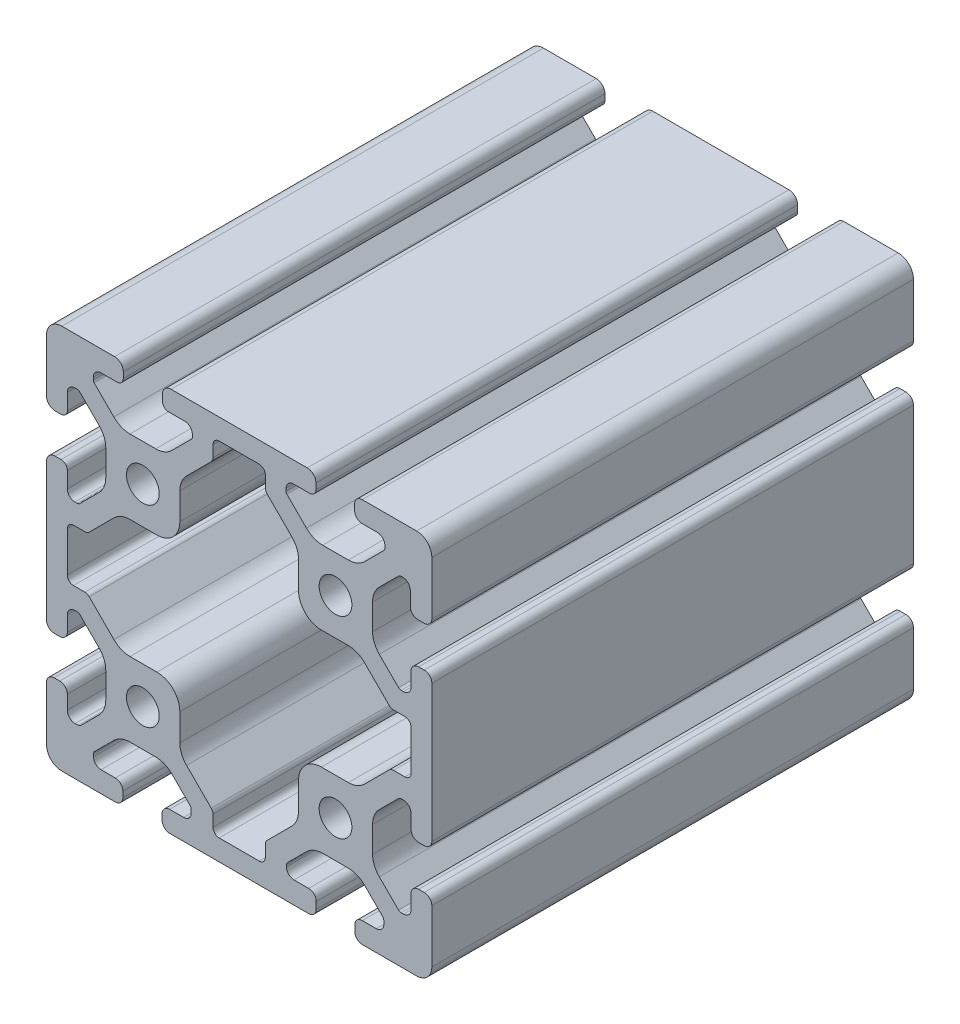
from build123d import *

# Parameters (mm, degrees)
SKETCH1_R      = 3.4
EXTRUDE1_DEPTH = 100


with BuildPart() as part:
    # Sketch1 → Extrude1 (new body)
    with BuildSketch(Plane.XY):
        with BuildLine():
            Line((29.091242789, 26.036541495), (33.082657296, 30.027956002))
            ThreePointArc((33.082657296, 30.027956002), (33.329219041, 30.192703293), (33.62005845, 30.250554848))
            Line((33.62005845, 30.250554848), (33.955571436, 30.250554848))
            ThreePointArc((33.955571436, 30.250554848), (35.065729082, 29.790712494), (35.525571436, 28.680554848))
            Line((35.525571436, 28.680554848), (35.525571436, 25.777866899))
            ThreePointArc((35.525571436, 25.777866899), (35.985413789, 24.667709253), (37.095571436, 24.207866899))
            Line((37.095571436, 24.207866899), (38.43, 24.207866899))
            ThreePointArc((38.43, 24.207866899), (39.540157646, 24.667709253), (40, 25.777866899))
            Line((40, 25.777866899), (40, 32.933852749))
            Line((40, 32.933852749), (40, 36.83))
            ThreePointArc((40, 36.83), (39.071528496, 39.071528496), (36.83, 40))
            Line((36.83, 40), (25.540851266, 40))
            ThreePointArc((25.540851266, 40), (24.43069362, 39.540157646), (23.970851266, 38.43))
            Line((23.970851266, 38.43), (23.970851266, 37.249043598))
            ThreePointArc((23.970851266, 37.249043598), (24.43069362, 36.138885952), (25.540851266, 35.679043598))
            Line((25.540851266, 35.679043598), (28.625762638, 35.679043598))
            ThreePointArc((28.625762638, 35.679043598), (29.77116849, 35.239363487), (30.250554848, 34.11))
            Line((30.250554848, 34.11), (30.250554848, 33.62005845))
            ThreePointArc((30.250554848, 33.62005845), (30.192703293, 33.329219041), (30.027956002, 33.082657296))
            Line((30.027956002, 33.082657296), (26.036541495, 29.091242789))
            ThreePointArc((26.036541495, 29.091242789), (24.495530588, 28.061572221), (22.677784284, 27.7))
            Line((22.677784284, 27.7), (17.322215716, 27.7))
            ThreePointArc((17.322215716, 27.7), (15.504469412, 28.061572221), (13.963458505, 29.091242789))
            Line((13.963458505, 29.091242789), (9.90393336, 33.150767934))
            ThreePointArc((9.90393336, 33.150767934), (9.764102181, 33.360040084), (9.715, 33.606893415))
            Line((9.715, 33.606893415), (9.715, 34.096834965))
            ThreePointArc((9.715, 34.096834965), (10.178698303, 35.216301697), (11.298165035, 35.68))
            Line((11.298165035, 35.68), (14.642754087, 35.68))
            ThreePointArc((14.642754087, 35.68), (15.560045469, 36.059954531), (15.94, 36.977245913))
            Line((15.94, 36.977245913), (15.94, 38.194841282))
            ThreePointArc((15.94, 38.194841282), (15.411281253, 39.471281253), (14.134841282, 40))
            Line((14.134841282, 40), (6.984433948, 40))
            Line((6.984433948, 40), (-6.984433948, 40))
            Line((-6.984433948, 40), (-14.134841282, 40))
            ThreePointArc((-14.134841282, 40), (-15.411281253, 39.471281253), (-15.94, 38.194841282))
            Line((-15.94, 38.194841282), (-15.94, 36.977245913))
            ThreePointArc((-15.94, 36.977245913), (-15.560045469, 36.059954531), (-14.642754087, 35.68))
            Line((-14.642754087, 35.68), (-11.298165035, 35.68))
            ThreePointArc((-11.298165035, 35.68), (-10.178698303, 35.216301697), (-9.715, 34.096834965))
            Line((-9.715, 34.096834965), (-9.715, 33.606893415))
            ThreePointArc((-9.715, 33.606893415), (-9.764102181, 33.360040084), (-9.90393336, 33.150767934))
            Line((-9.90393336, 33.150767934), (-13.963458505, 29.091242789))
            ThreePointArc((-13.963458505, 29.091242789), (-15.504469412, 28.061572221), (-17.322215716, 27.7))
            Line((-17.322215716, 27.7), (-22.677784284, 27.7))
            ThreePointArc((-22.677784284, 27.7), (-24.495530588, 28.061572221), (-26.036541495, 29.091242789))
            Line((-26.036541495, 29.091242789), (-30.09606664, 33.150767934))
            ThreePointArc((-30.09606664, 33.150767934), (-30.235897819, 33.360040084), (-30.285, 33.606893415))
            Line((-30.285, 33.606893415), (-30.285, 34.096834965))
            ThreePointArc((-30.285, 34.096834965), (-29.821301697, 35.216301697), (-28.701834965, 35.68))
            Line((-28.701834965, 35.68), (-25.357245913, 35.68))
            ThreePointArc((-25.357245913, 35.68), (-24.439954531, 36.059954531), (-24.06, 36.977245913))
            Line((-24.06, 36.977245913), (-24.06, 38.194841282))
            ThreePointArc((-24.06, 38.194841282), (-24.588718747, 39.471281253), (-25.865158718, 40))
            Line((-25.865158718, 40), (-33.031395847, 40))
            Line((-33.031395847, 40), (-36.83, 40))
            ThreePointArc((-36.83, 40), (-39.071528496, 39.071528496), (-40, 36.83))
            Line((-40, 36.83), (-40, 33.318079463))
            Line((-40, 33.318079463), (-40, 25.865158718))
            ThreePointArc((-40, 25.865158718), (-39.471281253, 24.588718747), (-38.194841282, 24.06))
            Line((-38.194841282, 24.06), (-36.977245913, 24.06))
            ThreePointArc((-36.977245913, 24.06), (-36.059954531, 24.439954531), (-35.68, 25.357245913))
            Line((-35.68, 25.357245913), (-35.68, 28.680554848))
            ThreePointArc((-35.68, 28.680554848), (-35.220157646, 29.790712494), (-34.11, 30.250554848))
            Line((-34.11, 30.250554848), (-33.62005845, 30.250554848))
            ThreePointArc((-33.62005845, 30.250554848), (-33.329219041, 30.192703293), (-33.082657296, 30.027956002))
            Line((-33.082657296, 30.027956002), (-29.091242789, 26.036541495))
            ThreePointArc((-29.091242789, 26.036541495), (-28.061572221, 24.495530588), (-27.7, 22.677784284))
            Line((-27.7, 22.677784284), (-27.7, 17.322215716))
            ThreePointArc((-27.7, 17.322215716), (-28.061572221, 15.504469412), (-29.091242789, 13.963458505))
            Line((-29.091242789, 13.963458505), (-33.082657296, 9.972043998))
            ThreePointArc((-33.082657296, 9.972043998), (-33.329219041, 9.807296707), (-33.62005845, 9.749445152))
            Line((-33.62005845, 9.749445152), (-34.11, 9.749445152))
            ThreePointArc((-34.11, 9.749445152), (-35.220157646, 10.209287506), (-35.68, 11.319445152))
            Line((-35.68, 11.319445152), (-35.68, 14.642754087))
            ThreePointArc((-35.68, 14.642754087), (-36.059954531, 15.560045469), (-36.977245913, 15.94))
            Line((-36.977245913, 15.94), (-38.194841282, 15.94))
            ThreePointArc((-38.194841282, 15.94), (-39.471281253, 15.411281253), (-40, 14.134841282))
            Line((-40, 14.134841282), (-40, 7.016888977))
            Line((-40, 7.016888977), (-40, -7.016888977))
            Line((-40, -7.016888977), (-40, -14.447338303))
            ThreePointArc((-40, -14.447338303), (-39.540157646, -15.557495949), (-38.43, -16.017338303))
            Line((-38.43, -16.017338303), (-37.25, -16.017338303))
            ThreePointArc((-37.25, -16.017338303), (-36.139842354, -15.557495949), (-35.68, -14.447338303))
            Line((-35.68, -14.447338303), (-35.68, -11.319445152))
            ThreePointArc((-35.68, -11.319445152), (-35.220157646, -10.209287506), (-34.11, -9.749445152))
            Line((-34.11, -9.749445152), (-33.62005845, -9.749445152))
            ThreePointArc((-33.62005845, -9.749445152), (-33.329219041, -9.807296707), (-33.082657296, -9.972043998))
            Line((-33.082657296, -9.972043998), (-29.091242789, -13.963458505))
            ThreePointArc((-29.091242789, -13.963458505), (-28.061572221, -15.504469412), (-27.7, -17.322215716))
            Line((-27.7, -17.322215716), (-27.7, -22.677784284))
            ThreePointArc((-27.7, -22.677784284), (-28.061572221, -24.495530588), (-29.091242789, -26.036541495))
            Line((-29.091242789, -26.036541495), (-32.871776968, -29.817075674))
            ThreePointArc((-32.871776968, -29.817075674), (-33.10612883, -29.976640176), (-33.382654504, -30.039211548))
            Line((-33.382654504, -30.039211548), (-34.05520779, -30.062697627))
            ThreePointArc((-34.05520779, -30.062697627), (-35.200613642, -29.623017515), (-35.68, -28.493654028))
            Line((-35.68, -28.493654028), (-35.68, -25.59096608))
            ThreePointArc((-35.68, -25.59096608), (-36.139842354, -24.480808433), (-37.25, -24.02096608))
            Line((-37.25, -24.02096608), (-38.43, -24.02096608))
            ThreePointArc((-38.43, -24.02096608), (-39.540157646, -24.480808433), (-40, -25.59096608))
            Line((-40, -25.59096608), (-40, -33.019082273))
            Line((-40, -33.019082273), (-40, -36.83))
            ThreePointArc((-40, -36.83), (-39.071528496, -39.071528496), (-36.83, -40))
            Line((-36.83, -40), (-33, -40))
            Line((-33, -40), (-25.72307469, -40))
            ThreePointArc((-25.72307469, -40), (-24.612917043, -39.540157646), (-24.15307469, -38.43))
            Line((-24.15307469, -38.43), (-24.15307469, -37.25))
            ThreePointArc((-24.15307469, -37.25), (-24.612917043, -36.139842354), (-25.72307469, -35.68))
            Line((-25.72307469, -35.68), (-28.680554848, -35.68))
            ThreePointArc((-28.680554848, -35.68), (-29.790712494, -35.220157646), (-30.250554848, -34.11))
            Line((-30.250554848, -34.11), (-30.250554848, -33.62005845))
            ThreePointArc((-30.250554848, -33.62005845), (-30.192703293, -33.329219041), (-30.027956002, -33.082657296))
            Line((-30.027956002, -33.082657296), (-26.036541495, -29.091242789))
            ThreePointArc((-26.036541495, -29.091242789), (-24.495530588, -28.061572221), (-22.677784284, -27.7))
            Line((-22.677784284, -27.7), (-17.322215716, -27.7))
            ThreePointArc((-17.322215716, -27.7), (-15.504469412, -28.061572221), (-13.963458505, -29.091242789))
            Line((-13.963458505, -29.091242789), (-10.203784275, -32.85091702))
            ThreePointArc((-10.203784275, -32.85091702), (-10.044219772, -33.085268882), (-9.9816484, -33.361794556))
            Line((-9.9816484, -33.361794556), (-9.957433876, -34.05520779))
            ThreePointArc((-9.957433876, -34.05520779), (-10.397113988, -35.200613642), (-11.526477474, -35.68))
            Line((-11.526477474, -35.68), (-14.429165423, -35.68))
            ThreePointArc((-14.429165423, -35.68), (-15.539323069, -36.139842354), (-15.999165423, -37.25))
            Line((-15.999165423, -37.25), (-15.999165423, -38.43))
            ThreePointArc((-15.999165423, -38.43), (-15.539323069, -39.540157646), (-14.429165423, -40))
            Line((-14.429165423, -40), (-6.998716097, -40))
            Line((-6.998716097, -40), (6.998716097, -40))
            Line((6.998716097, -40), (14.424638994, -40))
            ThreePointArc((14.424638994, -40), (15.53479664, -39.540157646), (15.994638994, -38.43))
            Line((15.994638994, -38.43), (15.994638994, -37.032644306))
            ThreePointArc((15.994638994, -37.032644306), (15.53479664, -35.922486659), (14.424638994, -35.462644306))
            Line((14.424638994, -35.462644306), (11.382372282, -35.462644306))
            ThreePointArc((11.382372282, -35.462644306), (10.272214636, -35.002801952), (9.812372282, -33.892644306))
            Line((9.812372282, -33.892644306), (9.812372282, -33.55713132))
            ThreePointArc((9.812372282, -33.55713132), (9.870223837, -33.266291912), (10.034971128, -33.019730166))
            Line((10.034971128, -33.019730166), (13.963458505, -29.091242789))
            ThreePointArc((13.963458505, -29.091242789), (15.504469412, -28.061572221), (17.322215716, -27.7))
            Line((17.322215716, -27.7), (22.677784284, -27.7))
            ThreePointArc((22.677784284, -27.7), (24.495530588, -28.061572221), (26.036541495, -29.091242789))
            Line((26.036541495, -29.091242789), (29.794925243, -32.849626538))
            ThreePointArc((29.794925243, -32.849626538), (29.954489746, -33.083978399), (30.017061118, -33.360504074))
            Line((30.017061118, -33.360504074), (30.041320706, -34.05520779))
            ThreePointArc((30.041320706, -34.05520779), (29.601640594, -35.200613642), (28.472277108, -35.68))
            Line((28.472277108, -35.68), (25.569589159, -35.68))
            ThreePointArc((25.569589159, -35.68), (24.459431513, -36.139842354), (23.999589159, -37.25))
            Line((23.999589159, -37.25), (23.999589159, -38.43))
            ThreePointArc((23.999589159, -38.43), (24.459431513, -39.540157646), (25.569589159, -40))
            Line((25.569589159, -40), (32.999849358, -40))
            Line((32.999849358, -40), (36.83, -40))
            ThreePointArc((36.83, -40), (39.071528496, -39.071528496), (40, -36.83))
            Line((40, -36.83), (40, -33.025941835))
            Line((40, -33.025941835), (40, -25.777866899))
            ThreePointArc((40, -25.777866899), (39.540157646, -24.667709253), (38.43, -24.207866899))
            Line((38.43, -24.207866899), (37.25, -24.207866899))
            ThreePointArc((37.25, -24.207866899), (36.139842354, -24.667709253), (35.68, -25.777866899))
            Line((35.68, -25.777866899), (35.68, -28.680554848))
            ThreePointArc((35.68, -28.680554848), (35.220157646, -29.790712494), (34.11, -30.250554848))
            Line((34.11, -30.250554848), (33.62005845, -30.250554848))
            ThreePointArc((33.62005845, -30.250554848), (33.329219041, -30.192703293), (33.082657296, -30.027956002))
            Line((33.082657296, -30.027956002), (29.091242789, -26.036541495))
            ThreePointArc((29.091242789, -26.036541495), (28.061572221, -24.495530588), (27.7, -22.677784284))
            Line((27.7, -22.677784284), (27.7, -17.322215716))
            ThreePointArc((27.7, -17.322215716), (28.061572221, -15.504469412), (29.091242789, -13.963458505))
            Line((29.091242789, -13.963458505), (33.082657296, -9.972043998))
            ThreePointArc((33.082657296, -9.972043998), (33.329219041, -9.807296707), (33.62005845, -9.749445152))
            Line((33.62005845, -9.749445152), (34.11, -9.749445152))
            ThreePointArc((34.11, -9.749445152), (35.220157646, -10.209287506), (35.68, -11.319445152))
            Line((35.68, -11.319445152), (35.68, -14.222133101))
            ThreePointArc((35.68, -14.222133101), (36.139842354, -15.332290747), (37.25, -15.792133101))
            Line((37.25, -15.792133101), (38.43, -15.792133101))
            ThreePointArc((38.43, -15.792133101), (39.540157646, -15.332290747), (40, -14.222133101))
            Line((40, -14.222133101), (40, -7.021415406))
            Line((40, -7.021415406), (40, 7.021415406))
            Line((40, 7.021415406), (40, 14.222133101))
            ThreePointArc((40, 14.222133101), (39.540157646, 15.332290747), (38.43, 15.792133101))
            Line((38.43, 15.792133101), (37.25, 15.792133101))
            ThreePointArc((37.25, 15.792133101), (36.139842354, 15.332290747), (35.68, 14.222133101))
            Line((35.68, 14.222133101), (35.68, 11.319445152))
            ThreePointArc((35.68, 11.319445152), (35.220157646, 10.209287506), (34.11, 9.749445152))
            Line((34.11, 9.749445152), (33.62005845, 9.749445152))
            ThreePointArc((33.62005845, 9.749445152), (33.329219041, 9.807296707), (33.082657296, 9.972043998))
            Line((33.082657296, 9.972043998), (29.091242789, 13.963458505))
            ThreePointArc((29.091242789, 13.963458505), (28.061572221, 15.504469412), (27.7, 17.322215716))
            Line((27.7, 17.322215716), (27.7, 22.677784284))
            ThreePointArc((27.7, 22.677784284), (28.061572221, 24.495530588), (29.091242789, 26.036541495))
        make_face()
        with Locations((-20, 20)):
            Circle(SKETCH1_R, mode=Mode.SUBTRACT)
        with Locations((20, 20)):
            Circle(SKETCH1_R, mode=Mode.SUBTRACT)
        with Locations((20, -20)):
            Circle(SKETCH1_R, mode=Mode.SUBTRACT)
        with Locations((-20, -20)):
            Circle(SKETCH1_R, mode=Mode.SUBTRACT)
        with BuildLine():
            Line((17.07, 12.32), (22.657784284, 12.32))
            ThreePointArc((22.657784284, 12.32), (24.475530588, 11.958427779), (26.016541495, 10.928757211))
            Line((26.016541495, 10.928757211), (31.143879165, 5.80141954))
            ThreePointArc((31.143879165, 5.80141954), (31.555896818, 5.526118146), (32.041904777, 5.429445152))
            Line((32.041904777, 5.429445152), (34.41, 5.429445152))
            ThreePointArc((34.41, 5.429445152), (35.308025612, 5.057470764), (35.68, 4.159445152))
            Line((35.68, 4.159445152), (35.68, -4.159445152))
            ThreePointArc((35.68, -4.159445152), (35.308025612, -5.057470764), (34.41, -5.429445152))
            Line((34.41, -5.429445152), (32.041904777, -5.429445152))
            ThreePointArc((32.041904777, -5.429445152), (31.555896818, -5.526118146), (31.143879165, -5.80141954))
            Line((31.143879165, -5.80141954), (26.016541495, -10.928757211))
            ThreePointArc((26.016541495, -10.928757211), (24.475530588, -11.958427779), (22.657784284, -12.32))
            Line((22.657784284, -12.32), (17.07, -12.32))
            ThreePointArc((17.07, -12.32), (13.711242789, -13.711242789), (12.32, -17.07))
            Line((12.32, -17.07), (12.32, -22.657784284))
            ThreePointArc((12.32, -22.657784284), (11.958427779, -24.475530588), (10.928757211, -26.016541495))
            Line((10.928757211, -26.016541495), (5.80141954, -31.143879165))
            ThreePointArc((5.80141954, -31.143879165), (5.526118146, -31.555896818), (5.429445152, -32.041904777))
            Line((5.429445152, -32.041904777), (5.429445152, -34.41))
            ThreePointArc((5.429445152, -34.41), (5.057470764, -35.308025612), (4.159445152, -35.68))
            Line((4.159445152, -35.68), (-4.159445152, -35.68))
            ThreePointArc((-4.159445152, -35.68), (-5.057470764, -35.308025612), (-5.429445152, -34.41))
            Line((-5.429445152, -34.41), (-5.429445152, -32.041904777))
            ThreePointArc((-5.429445152, -32.041904777), (-5.526118146, -31.555896818), (-5.80141954, -31.143879165))
            Line((-5.80141954, -31.143879165), (-10.928757211, -26.016541495))
            ThreePointArc((-10.928757211, -26.016541495), (-11.958427779, -24.475530588), (-12.32, -22.657784284))
            Line((-12.32, -22.657784284), (-12.32, -17.07))
            ThreePointArc((-12.32, -17.07), (-13.711242789, -13.711242789), (-17.07, -12.32))
            Line((-17.07, -12.32), (-22.657784284, -12.32))
            ThreePointArc((-22.657784284, -12.32), (-24.475530588, -11.958427779), (-26.016541495, -10.928757211))
            Line((-26.016541495, -10.928757211), (-31.143879165, -5.80141954))
            ThreePointArc((-31.143879165, -5.80141954), (-31.555896818, -5.526118146), (-32.041904777, -5.429445152))
            Line((-32.041904777, -5.429445152), (-34.41, -5.429445152))
            ThreePointArc((-34.41, -5.429445152), (-35.308025612, -5.057470764), (-35.68, -4.159445152))
            Line((-35.68, -4.159445152), (-35.68, 4.159445152))
            ThreePointArc((-35.68, 4.159445152), (-35.308025612, 5.057470764), (-34.41, 5.429445152))
            Line((-34.41, 5.429445152), (-32.041904777, 5.429445152))
            ThreePointArc((-32.041904777, 5.429445152), (-31.555896818, 5.526118146), (-31.143879165, 5.80141954))
            Line((-31.143879165, 5.80141954), (-26.016541495, 10.928757211))
            ThreePointArc((-26.016541495, 10.928757211), (-24.475530588, 11.958427779), (-22.657784284, 12.32))
            Line((-22.657784284, 12.32), (-17.07, 12.32))
            ThreePointArc((-17.07, 12.32), (-13.711242789, 13.711242789), (-12.32, 17.07))
            Line((-12.32, 17.07), (-12.32, 22.657784284))
            ThreePointArc((-12.32, 22.657784284), (-11.958427779, 24.475530588), (-10.928757211, 26.016541495))
            Line((-10.928757211, 26.016541495), (-5.80141954, 31.143879165))
            ThreePointArc((-5.80141954, 31.143879165), (-5.526118146, 31.555896818), (-5.429445152, 32.041904777))
            Line((-5.429445152, 32.041904777), (-5.429445152, 34.41))
            ThreePointArc((-5.429445152, 34.41), (-5.057470764, 35.308025612), (-4.159445152, 35.68))
            Line((-4.159445152, 35.68), (4.159445152, 35.68))
            ThreePointArc((4.159445152, 35.68), (5.057470764, 35.308025612), (5.429445152, 34.41))
            Line((5.429445152, 34.41), (5.429445152, 32.041904777))
            ThreePointArc((5.429445152, 32.041904777), (5.526118146, 31.555896818), (5.80141954, 31.143879165))
            Line((5.80141954, 31.143879165), (10.928757211, 26.016541495))
            ThreePointArc((10.928757211, 26.016541495), (11.958427779, 24.475530588), (12.32, 22.657784284))
            Line((12.32, 22.657784284), (12.32, 17.07))
            ThreePointArc((12.32, 17.07), (13.711242789, 13.711242789), (17.07, 12.32))
        make_face(mode=Mode.SUBTRACT)
    extrude(amount=-EXTRUDE1_DEPTH)


solid = part.part
